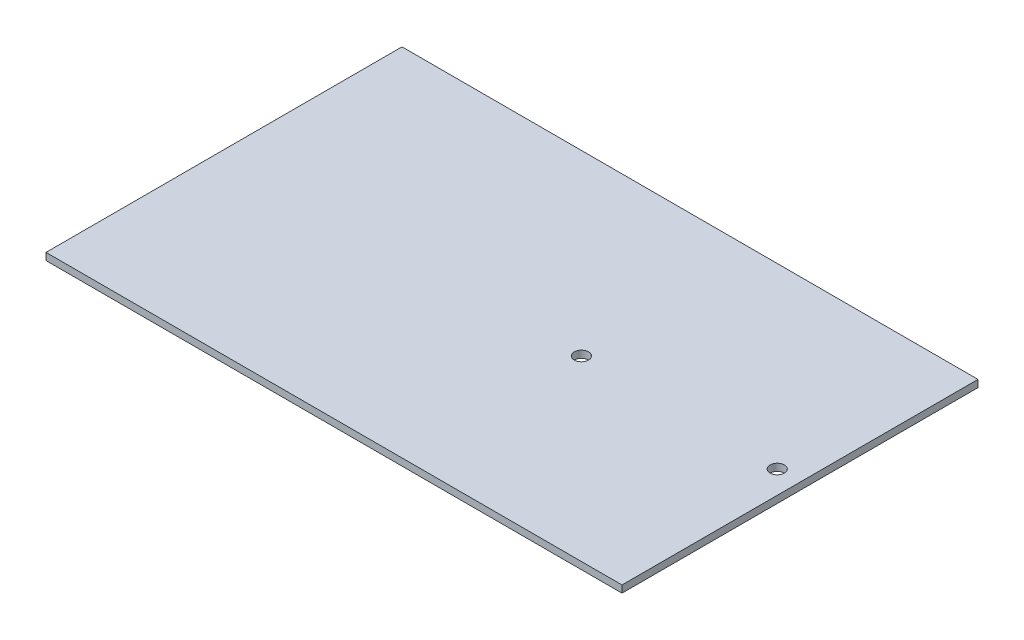
from build123d import *

# Parameters (mm, degrees)
ESBO_O1_W                = 80.9
ESBO_O1_H                = 50
RESSALTO_EXTRUS_O1_DEPTH = 1
ESBO_O2_R                = 1
CORTE_EXTRUS_O1_DEPTH    = 48.562616623


with BuildPart() as part:
    # Esboço1 → Ressalto-extrusão1 (new body)
    with BuildSketch(Plane(origin=(0, 0, 0), x_dir=(1, 0, 0), z_dir=(0, 1, 0))):
        Rectangle(ESBO_O1_W, ESBO_O1_H)
    extrude(amount=RESSALTO_EXTRUS_O1_DEPTH)

    # Esboço2 → Corte-extrusão1 (cut, through all)
    with BuildSketch(Plane(origin=(0, 1, 0), x_dir=(1, 0, 0), z_dir=(0, 1, 0))):
        with Locations(Location((37.25, 0, 0), (0, 0, 270))):
            Circle(ESBO_O2_R)
        with Locations(Location((9.75, 0, 0), (0, 0, 270))):
            Circle(ESBO_O2_R)
    extrude(amount=-CORTE_EXTRUS_O1_DEPTH, mode=Mode.SUBTRACT)


solid = part.part
